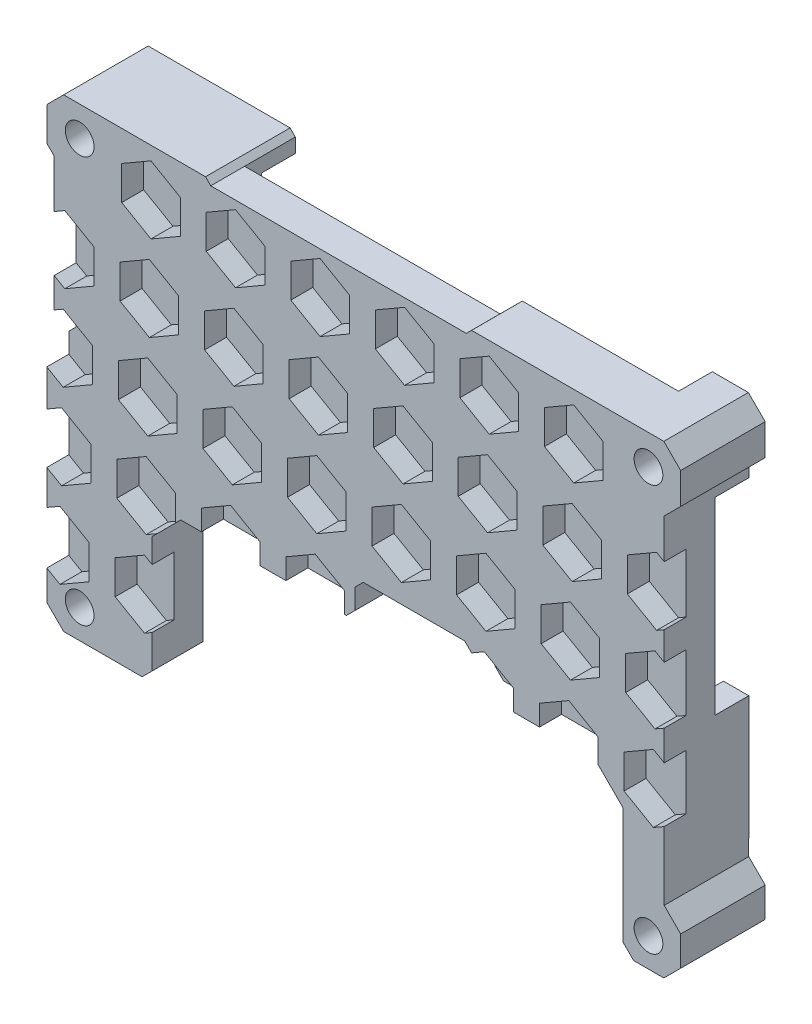
from build123d import *

# Parameters (mm, degrees)
SKETCH_1_W           = 85
SKETCH_1_H           = 65
EXTRUDE_1_DEPTH      = 10
CUT_EXTRUDE_1_REACH  = 109.471
SKETCH_2_R           = 1.7
CUT_EXTRUDE_2_REACH  = 109.471
SKETCH_3_W           = 85
SKETCH_3_H           = 65
CUT_EXTRUDE_4_REACH  = 102.464
CUT_EXTRUDE_7_DEPTH  = 6
CUT_EXTRUDE_8_DEPTH  = 6
CUT_EXTRUDE_11_DEPTH = 4
SKETCH_8_W           = 8
SKETCH_8_H           = 5
CUT_EXTRUDE_12_DEPTH = 1
SKETCH_10_W          = 5.4
SKETCH_10_H          = 6
SKETCH_10_W_2        = 4
EXTRUDE_2_DEPTH      = 3.04
SKETCH_11_W          = 4.2
SKETCH_11_H          = 5
EXTRUDE_3_DEPTH      = 2.300115
SKETCH_12_W          = 12
SKETCH_12_H          = 6
EXTRUDE_4_DEPTH      = 2.89
SKETCH_14_W          = 6
SKETCH_14_H          = 7
EXTRUDE_6_DEPTH      = 2.890002
SKETCH_15_W          = 14
SKETCH_15_H          = 4.4
CUT_EXTRUDE_13_DEPTH = 6
CHAMFER_1_SIZE       = 1
CHAMFER_3_SIZE       = 0.6
CHAMFER_4_SIZE       = 0.6
CHAMFER_5_SIZE       = 0.6
CHAMFER_6_SIZE       = 0.6
CUT_EXTRUDE_14_DEPTH = 2.6
SKETCH_17_W          = 2.4
SKETCH_17_H          = 7.999811284
CUT_EXTRUDE_15_DEPTH = 4
CUT_EXTRUDE_START    = -4.684929
SKETCH_19_W          = 2
SKETCH_19_H          = 10.545584206
CUT_EXTRUDE_16_DEPTH = 4.684929


with BuildPart() as part:
    # 草图1 → 凸台-拉伸1 (new body)
    with BuildSketch(Plane.XY):
        with Locations((42.5, 32.5)):
            Rectangle(SKETCH_1_W, SKETCH_1_H)
    extrude(amount=EXTRUDE_1_DEPTH)

    # 草图2 → 切除-拉伸1 (cut, up to next)
    with BuildSketch(Plane(origin=(0, 0, 0), x_dir=(-1, 0, 0), z_dir=(0, 0, -1)), mode=Mode.PRIVATE) as cut_extrude_1_sk1:
        with Locations((-76.166921514, 56.442524765)):
            Circle(SKETCH_2_R)
    cut_extrude_1_tool1 = extrude(cut_extrude_1_sk1.sketch, amount=-CUT_EXTRUDE_1_REACH, mode=Mode.PRIVATE) & part.part
    # 草图2 → 切除-拉伸1 (cut, up to next)
    with BuildSketch(Plane(origin=(0, 0, 0), x_dir=(-1, 0, 0), z_dir=(0, 0, -1)), mode=Mode.PRIVATE) as cut_extrude_1_sk2:
        with Locations((-8.888803658, 56.442524765)):
            Circle(SKETCH_2_R)
    cut_extrude_1_tool2 = extrude(cut_extrude_1_sk2.sketch, amount=-CUT_EXTRUDE_1_REACH, mode=Mode.PRIVATE) & part.part
    # 草图2 → 切除-拉伸1 (cut, up to next)
    with BuildSketch(Plane(origin=(0, 0, 0), x_dir=(-1, 0, 0), z_dir=(0, 0, -1)), mode=Mode.PRIVATE) as cut_extrude_1_sk3:
        with Locations((-76.166921514, 8.41508509)):
            Circle(SKETCH_2_R)
    cut_extrude_1_tool3 = extrude(cut_extrude_1_sk3.sketch, amount=-CUT_EXTRUDE_1_REACH, mode=Mode.PRIVATE) & part.part
    # 草图2 → 切除-拉伸1 (cut, up to next)
    with BuildSketch(Plane(origin=(0, 0, 0), x_dir=(-1, 0, 0), z_dir=(0, 0, -1)), mode=Mode.PRIVATE) as cut_extrude_1_sk4:
        with Locations((-8.888803658, 8.41508509)):
            Circle(SKETCH_2_R)
    cut_extrude_1_tool4 = extrude(cut_extrude_1_sk4.sketch, amount=-CUT_EXTRUDE_1_REACH, mode=Mode.PRIVATE) & part.part
    add(cut_extrude_1_tool1.solids().sort_by_distance((76.166922, 56.442525, 0))[0], mode=Mode.SUBTRACT)
    add(cut_extrude_1_tool2.solids().sort_by_distance((8.888804, 56.442525, 0))[0], mode=Mode.SUBTRACT)
    add(cut_extrude_1_tool3.solids().sort_by_distance((76.166922, 8.415085, 0))[0], mode=Mode.SUBTRACT)
    add(cut_extrude_1_tool4.solids().sort_by_distance((8.888804, 8.415085, 0))[0], mode=Mode.SUBTRACT)

    # 草图3 → 切除-拉伸2 (cut, up to next)
    with BuildSketch(Plane(origin=(0, 0, 0), x_dir=(-1, 0, 0), z_dir=(0, 0, -1)), mode=Mode.PRIVATE) as cut_extrude_2_sk1:
        with Locations((-42.5, 32.5)):
            Rectangle(SKETCH_3_W, SKETCH_3_H)
        Polygon((-5, 33.462892894), (-5.871324699, 34.334217592), (-5.87504445, 53.137061214), (-5, 54.017366187), (-5, 57.982143592), (-6.992565577, 59.974709169), (-23.773560915, 59.974709169), (-24.394872914, 59.353397171), (-54.61482093, 59.349677419), (-55.245113202, 59.974709169), (-77.982184232, 59.974709169), (-79.974749809, 57.982143592), (-79.97474981, 54.295829484), (-78.032030648, 52.353110322), (-78.028310897, 12.45999492), (-79.97474981, 10.508295484), (-79.97474981, 6.992565577), (-77.982184232, 5), (-74.414239441, 5), (-73.152434681, 6.26180476), (-60.043505207, 6.265524511), (-58.772720173, 5), (-32.926479725, 5), (-31.743585303, 6.182894422), (-17.461559563, 6.186614173), (-16.269684867, 5), (-6.992565577, 5), (-5, 6.992565577), align=None, mode=Mode.SUBTRACT)
    cut_extrude_2_tool1 = extrude(cut_extrude_2_sk1.sketch, amount=-CUT_EXTRUDE_2_REACH, mode=Mode.PRIVATE) & part.part
    add(cut_extrude_2_tool1.solids().sort_by_distance((42.5, 63.929953, 0))[0], mode=Mode.SUBTRACT)

    # 草图4 → 切除-拉伸4 (cut, up to next)
    with BuildSketch(Plane(origin=(0, 0, 0), x_dir=(-1, 0, 0), z_dir=(0, 0, -1)), mode=Mode.PRIVATE) as cut_extrude_4_sk1:
        Polygon((-73.152434681, 6.26180476), (-73.152434681, 20.032317315), (-69.831576581, 23.353175415), (-46.787984184, 23.353175415), (-20.851296271, 23.353175415), (-17.461559563, 19.963438707), (-17.461559563, 6.186614173), (-17.461559563, 0.193960815), (-73.152434681, 0.193960815), align=None)
    cut_extrude_4_tool1 = extrude(cut_extrude_4_sk1.sketch, amount=-CUT_EXTRUDE_4_REACH, mode=Mode.PRIVATE) & part.part
    add(cut_extrude_4_tool1.solids().sort_by_distance((45.311727, 11.681443, 0))[0], mode=Mode.SUBTRACT)

    # 草图5 → 切除-拉伸7 (cut)
    with BuildSketch(Plane(origin=(0, 0, 0), x_dir=(-1, 0, 0), z_dir=(0, 0, -1))):
        Polygon((-24.394872914, 59.353397171), (-24.394872914, 53.906418167), (-25.526104495, 52.774908066), (-53.482640788, 52.774908066), (-54.614150889, 53.906139647), (-54.61482093, 59.349677419), align=None)
    extrude(amount=-CUT_EXTRUDE_7_DEPTH, mode=Mode.SUBTRACT)

    # 草图6 → 切除-拉伸8 (cut)
    with BuildSketch(Plane(origin=(0, 0, 0), x_dir=(-1, 0, 0), z_dir=(0, 0, -1))):
        Polygon((-10.273410923, 44.879801592), (-5.873410923, 44.879801592), (-5.87504445, 53.137061214), (-10.556253636, 53.137061214), (-11.687624485, 52.005690364), (-11.687624485, 43.465588029), align=None)
        Polygon((-5.873410923, 44.879801592), (-5.873410923, 34.33421718), (-10.556253636, 34.33421718), (-11.687624485, 35.465588029), (-11.687624485, 43.465588029), (-10.273410923, 44.879801592), align=None)
    extrude(amount=-CUT_EXTRUDE_8_DEPTH, mode=Mode.SUBTRACT)

    # 草图7 → 切除-拉伸11 (cut)
    with BuildSketch(Plane(origin=(0, 0, 0), x_dir=(-1, 0, 0), z_dir=(0, 0, -1))):
        Polygon((-74.432117646, 51.26230094), (-76.432117646, 51.26230094), (-78.031928938, 51.26230094), (-78.029847328, 28.93771831), (-75.029847328, 28.93771831), (-75.029847328, 13.93771831), (-73.152434681, 12.060305663), (-73.152434681, 20.032317315), (-69.831576581, 23.353175415), (-20.851296271, 23.353175415), (-17.461559563, 19.963438707), (-17.461559563, 6.186614173), (-16.269684867, 5), (-12.014024847, 5), (-12.014024847, 10.599811284), (-10.599811284, 12.014024847), (-6.599811284, 12.014024847), (-5, 12.014024847), (-5, 33.462892894), (-5.871324699, 34.334217592), (-5.873410923, 44.879801592), (-5.873410923, 34.33421718), (-10.556253636, 34.33421718), (-11.687624485, 35.465588029), (-11.687624485, 52.005690364), (-10.556253636, 53.137061214), (-9.87504445, 53.137061214), (-12.071959353, 55.333976117), (-12.071959353, 58.333976117), (-23.061659554, 58.333976117), (-23.732127818, 57.663342778), (-24.394872914, 57.663261201), (-24.394872914, 53.906418167), (-25.526104495, 52.774908066), (-53.482640788, 52.774908066), (-54.614150889, 53.906139647), (-54.61482093, 59.349677419), (-55.245113202, 59.974709169), (-71.319520701, 59.974709169), (-71.319520701, 58.374897885), (-71.319520701, 54.374897885), align=None)
    extrude(amount=-CUT_EXTRUDE_11_DEPTH, mode=Mode.SUBTRACT)

    # 草图8 → 切除-拉伸12 (cut)
    with BuildSketch(Plane(origin=(0, 0, 4), x_dir=(-1, 0, 0), z_dir=(0, 0, -1))):
        with Locations((-69.348077333, 43.45871309)):
            Rectangle(SKETCH_8_W, SKETCH_8_H)
    extrude(amount=-CUT_EXTRUDE_12_DEPTH, mode=Mode.SUBTRACT)

    # 草图10 → 凸台-拉伸2 (add)
    with BuildSketch(Plane(origin=(0, 0, 4), x_dir=(-1, 0, 0), z_dir=(0, 0, -1))):
        with Locations((-44.246532103, 31.889800214)):
            Rectangle(SKETCH_10_W, SKETCH_10_H)
        with Locations((-39.546532103, 31.889800214)):
            Rectangle(SKETCH_10_W_2, SKETCH_10_H)
        with Locations((-34.846532103, 31.889800214)):
            Rectangle(SKETCH_10_W, SKETCH_10_H)
    extrude(amount=EXTRUDE_2_DEPTH)

    # 草图11 → 凸台-拉伸3 (add)
    with BuildSketch(Plane(origin=(0, 0, 4), x_dir=(-1, 0, 0), z_dir=(0, 0, -1))):
        with Locations((-38.731800654, 41.192864876)):
            Rectangle(SKETCH_11_W, SKETCH_11_H)
    extrude(amount=EXTRUDE_3_DEPTH)

    # 草图12 → 凸台-拉伸4 (add)
    with BuildSketch(Plane(origin=(0, 0, 4), x_dir=(-1, 0, 0), z_dir=(0, 0, -1))):
        with Locations((-24.610605003, 27.685920752)):
            Rectangle(SKETCH_12_W, SKETCH_12_H)
    extrude(amount=EXTRUDE_4_DEPTH)

    # 草图14 → 凸台-拉伸6 (add)
    with BuildSketch(Plane(origin=(0, 0, 4), x_dir=(-1, 0, 0), z_dir=(0, 0, -1))):
        with Locations((-62.740849727, 27.111901224)):
            Rectangle(SKETCH_14_W, SKETCH_14_H)
    extrude(amount=EXTRUDE_6_DEPTH)

    # 草图15 → 切除-拉伸13 (cut)
    with BuildSketch(Plane.XY.offset(10)):
        with Locations((48.428848604, 25.553175415)):
            Rectangle(SKETCH_15_W, SKETCH_15_H)
    extrude(amount=-CUT_EXTRUDE_13_DEPTH, mode=Mode.SUBTRACT)

    # 倒角1
    chamfer_1_edges = [part.edges().sort_by_distance(p)[0] for p in [
        (55.428848604, 23.353175415, 7),
        (55.428848604, 27.753175415, 7),
        (41.428848604, 27.753175415, 7),
        (41.428848604, 23.353175415, 7),
    ]]
    chamfer(chamfer_1_edges, length=CHAMFER_1_SIZE)

    # 倒角3
    chamfer_3_edges = [part.edges().sort_by_distance(p)[0] for p in [
        (39.546532103, 28.889800214, 4),
        (46.946532103, 31.889800214, 4),
        (39.546532103, 34.889800214, 4),
        (32.146532103, 31.889800214, 4),
    ]]
    chamfer(chamfer_3_edges, length=CHAMFER_3_SIZE)

    # 倒角4
    chamfer_4_edges = [part.edges().sort_by_distance(p)[0] for p in [
        (30.610605003, 27.685920752, 4),
        (24.610605003, 24.685920752, 4),
        (18.610605003, 27.685920752, 4),
        (24.610605003, 30.685920752, 4),
    ]]
    chamfer(chamfer_4_edges, length=CHAMFER_4_SIZE)

    # 倒角5
    chamfer_5_edges = [part.edges().sort_by_distance(p)[0] for p in [
        (40.831800654, 41.192864876, 4),
        (38.731800654, 38.692864876, 4),
        (36.631800654, 41.192864876, 4),
        (38.731800654, 43.692864876, 4),
    ]]
    chamfer(chamfer_5_edges, length=CHAMFER_5_SIZE)

    # 倒角6
    chamfer_6_edges = [part.edges().sort_by_distance(p)[0] for p in [
        (65.740849727, 27.111901224, 4),
        (59.740849727, 27.111901224, 4),
        (62.740849727, 30.611901224, 4),
    ]]
    chamfer(chamfer_6_edges, length=CHAMFER_6_SIZE)

    # 草图16 → 切除-拉伸14 (cut)
    with BuildSketch(Plane.XY.offset(10)):
        Polygon((20.787277948, 52.374709169), (20.787277948, 56.374709169), (17.323176333, 58.374709169), (13.859074717, 56.374709169), (13.859074717, 52.374709169), (17.323176333, 50.374709169), align=None)
        Polygon((30.787277948, 52.374709169), (30.787277948, 56.374709169), (27.323176333, 58.374709169), (23.859074717, 56.374709169), (23.859074717, 52.374709169), (27.323176333, 50.374709169), align=None)
        Polygon((40.787277948, 52.374709169), (40.787277948, 56.374709169), (37.323176333, 58.374709169), (33.859074717, 56.374709169), (33.859074717, 52.374709169), (37.323176333, 50.374709169), align=None)
        Polygon((50.787277948, 52.374709169), (50.787277948, 56.374709169), (47.323176333, 58.374709169), (43.859074717, 56.374709169), (43.859074717, 52.374709169), (47.323176333, 50.374709169), align=None)
        Polygon((60.787277948, 52.374709169), (60.787277948, 56.374709169), (57.323176333, 58.374709169), (53.859074717, 56.374709169), (53.859074717, 52.374709169), (57.323176333, 50.374709169), align=None)
        Polygon((70.787277948, 52.374709169), (70.787277948, 56.374709169), (67.323176333, 58.374709169), (63.859074717, 56.374709169), (63.859074717, 52.374709169), (67.323176333, 50.374709169), align=None)
        Polygon((20.595040804, 42.182472025), (20.595040804, 46.182472025), (17.130939188, 48.182472025), (13.666837573, 46.182472025), (13.666837573, 42.182472025), (17.130939188, 40.182472025), align=None)
        Polygon((30.595040804, 42.182472025), (30.595040804, 46.182472025), (27.130939188, 48.182472025), (23.666837573, 46.182472025), (23.666837573, 42.182472025), (27.130939188, 40.182472025), align=None)
        Polygon((40.595040804, 42.182472025), (40.595040804, 46.182472025), (37.130939188, 48.182472025), (33.666837573, 46.182472025), (33.666837573, 42.182472025), (37.130939188, 40.182472025), align=None)
        Polygon((50.595040804, 42.182472025), (50.595040804, 46.182472025), (47.130939188, 48.182472025), (43.666837573, 46.182472025), (43.666837573, 42.182472025), (47.130939188, 40.182472025), align=None)
        Polygon((60.595040804, 42.182472025), (60.595040804, 46.182472025), (57.130939188, 48.182472025), (53.666837573, 46.182472025), (53.666837573, 42.182472025), (57.130939188, 40.182472025), align=None)
        Polygon((70.595040804, 42.182472025), (70.595040804, 46.182472025), (67.130939188, 48.182472025), (63.666837573, 46.182472025), (63.666837573, 42.182472025), (67.130939188, 40.182472025), align=None)
        Polygon((80.595040804, 42.182472025), (80.595040804, 46.182472025), (77.130939188, 48.182472025), (73.666837573, 46.182472025), (73.666837573, 42.182472025), (77.130939188, 40.182472025), align=None)
        Polygon((10.40280366, 31.990234881), (10.40280366, 35.990234881), (6.938702044, 37.990234881), (3.474600429, 35.990234881), (3.474600429, 31.990234881), (6.938702044, 29.990234881), align=None)
        Polygon((20.40280366, 31.990234881), (20.40280366, 35.990234881), (16.938702044, 37.990234881), (13.474600429, 35.990234881), (13.474600429, 31.990234881), (16.938702044, 29.990234881), align=None)
        Polygon((30.40280366, 31.990234881), (30.40280366, 35.990234881), (26.938702044, 37.990234881), (23.474600429, 35.990234881), (23.474600429, 31.990234881), (26.938702044, 29.990234881), align=None)
        Polygon((40.40280366, 31.990234881), (40.40280366, 35.990234881), (36.938702044, 37.990234881), (33.474600429, 35.990234881), (33.474600429, 31.990234881), (36.938702044, 29.990234881), align=None)
        Polygon((50.40280366, 31.990234881), (50.40280366, 35.990234881), (46.938702044, 37.990234881), (43.474600429, 35.990234881), (43.474600429, 31.990234881), (46.938702044, 29.990234881), align=None)
        Polygon((60.40280366, 31.990234881), (60.40280366, 35.990234881), (56.938702044, 37.990234881), (53.474600429, 35.990234881), (53.474600429, 31.990234881), (56.938702044, 29.990234881), align=None)
        Polygon((70.40280366, 31.990234881), (70.40280366, 35.990234881), (66.938702044, 37.990234881), (63.474600429, 35.990234881), (63.474600429, 31.990234881), (66.938702044, 29.990234881), align=None)
        Polygon((80.40280366, 31.990234881), (80.40280366, 35.990234881), (76.938702044, 37.990234881), (73.474600429, 35.990234881), (73.474600429, 31.990234881), (76.938702044, 29.990234881), align=None)
        Polygon((10.210566516, 21.797997737), (10.210566516, 25.797997737), (6.7464649, 27.797997737), (3.282363285, 25.797997737), (3.282363285, 21.797997737), (6.7464649, 19.797997737), align=None)
        Polygon((20.210566516, 21.797997737), (20.210566516, 25.797997737), (16.7464649, 27.797997737), (13.282363285, 25.797997737), (13.282363285, 21.797997737), (16.7464649, 19.797997737), align=None)
        Polygon((30.210566516, 21.797997737), (30.210566516, 25.797997737), (26.7464649, 27.797997737), (23.282363285, 25.797997737), (23.282363285, 21.797997737), (26.7464649, 19.797997737), align=None)
        Polygon((40.210566516, 21.797997737), (40.210566516, 25.797997737), (36.7464649, 27.797997737), (33.282363285, 25.797997737), (33.282363285, 21.797997737), (36.7464649, 19.797997737), align=None)
        Polygon((60.210566516, 21.797997737), (60.210566516, 25.797997737), (56.7464649, 27.797997737), (53.282363285, 25.797997737), (53.282363285, 21.797997737), (56.7464649, 19.797997737), align=None)
        Polygon((70.210566516, 21.797997737), (70.210566516, 25.797997737), (66.7464649, 27.797997737), (63.282363285, 25.797997737), (63.282363285, 21.797997737), (66.7464649, 19.797997737), align=None)
        Polygon((80.210566516, 21.797997737), (80.210566516, 25.797997737), (76.7464649, 27.797997737), (73.282363285, 25.797997737), (73.282363285, 21.797997737), (76.7464649, 19.797997737), align=None)
        Polygon((10.018329372, 11.605760593), (10.018329372, 15.605760593), (6.554227756, 17.605760593), (3.090126141, 15.605760593), (3.090126141, 11.605760593), (6.554227756, 9.605760593), align=None)
        Polygon((20.018329372, 11.605760593), (20.018329372, 15.605760593), (16.554227756, 17.605760593), (13.090126141, 15.605760593), (13.090126141, 11.605760593), (16.554227756, 9.605760593), align=None)
        Polygon((10.595040804, 42.182472025), (10.595040804, 46.182472025), (7.130939188, 48.182472025), (3.666837573, 46.182472025), (3.666837573, 42.182472025), (7.130939188, 40.182472025), align=None)
    extrude(amount=-CUT_EXTRUDE_14_DEPTH, mode=Mode.SUBTRACT)

    # 草图17 → 切除-拉伸15 (cut)
    with BuildSketch(Plane(origin=(0, 0, 0), x_dir=(-1, 0, 0), z_dir=(0, 0, -1))):
        with Locations((-72.519520701, 55.974803527)):
            Rectangle(SKETCH_17_W, SKETCH_17_H)
    extrude(amount=-CUT_EXTRUDE_15_DEPTH, mode=Mode.SUBTRACT)

    # 草图19 → 切除-拉伸16 (cut)
    with BuildSketch(Plane(origin=(5.864532159, -0.001160176, 0), x_dir=(0, 0, 1), z_dir=(-0.9999999804318066, 0.00019782918584162253, 0)).offset(CUT_EXTRUDE_START)):
        with Locations((5, 39.608170543)):
            Rectangle(SKETCH_19_W, SKETCH_19_H)
    extrude(amount=CUT_EXTRUDE_16_DEPTH, mode=Mode.SUBTRACT)


solid = part.part
